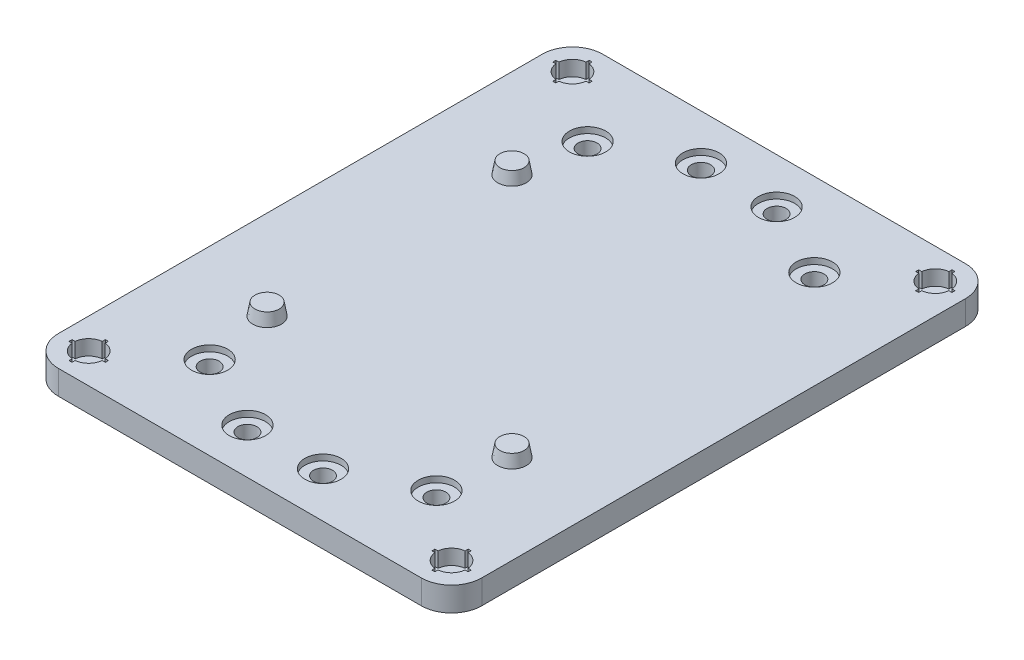
from build123d import *

# Parameters (mm, degrees)
SKETCH_1_W                                 = 200
SKETCH_1_H                                 = 200
SKETCH_1_R                                 = 3.2
SKETCH_1_R_2                               = 3.15
EXTRUDE_1_DEPTH                            = 8
SKETCH_2_R                                 = 6
CUT_EXTRUDE_1_DEPTH                        = 2
SKETCH_3_W                                 = 200
SKETCH_3_H                                 = 200
SKETCH_3_W_2                               = 140
SKETCH_3_H_2                               = 180
CUT_EXTRUDE_2_DEPTH                        = 10
FILLET_1_R                                 = 10
FILLET_2_R                                 = 10
FILLET_3_R                                 = 10
FILLET_4_R                                 = 10
CUT_EXTRUDE_5_DEPTH                        = 5
MIRROR_7_AT_THE_SECOND_PLANE_COPY_1_DEPTH  = 5
SKETCH_15_R                                = 4
EXTRUDE_2_DEPTH                            = 4
DRAFT_3_ANGLE                              = 10
DRAFT_3_OF_MIRROR_13_2_ANGLE               = 10
DRAFT_3_OF_MIRROR_14_2_ANGLE               = 10
SKETCH_16_R                                = 1.2
CUT_EXTRUDE_6_DEPTH                        = 115.297856498
MIRROR_15_AT_THE_SECOND_PLANE_COPY_1_SKE_R = 1.2
MIRROR_15_AT_THE_SECOND_PLANE_COPY_1_DEPTH = 115.297856498


with BuildPart() as part:
    # 草图1 → 凸台-拉伸1 (new body)
    with BuildSketch(Plane(origin=(0, 0, 0), x_dir=(1, 0, 0), z_dir=(0, 1, 0))):
        Rectangle(SKETCH_1_W, SKETCH_1_H)
        with Locations(Location((-12.5, 75, 0), (0, 0, 270))):
            Circle(SKETCH_1_R, mode=Mode.SUBTRACT)
        with Locations(Location((12.5, 75, 0), (0, 0, 270))):
            Circle(SKETCH_1_R_2, mode=Mode.SUBTRACT)
        with Locations(Location((-12.5, -75, 0), (0, 0, 270))):
            Circle(SKETCH_1_R_2, mode=Mode.SUBTRACT)
        with Locations(Location((12.5, -75, 0), (0, 0, 270))):
            Circle(SKETCH_1_R_2, mode=Mode.SUBTRACT)
        with Locations(Location((-37.5, -62.5, 0), (0, 0, 270))):
            Circle(SKETCH_1_R_2, mode=Mode.SUBTRACT)
        with Locations(Location((37.5, -62.5, 0), (0, 0, 270))):
            Circle(SKETCH_1_R_2, mode=Mode.SUBTRACT)
        with Locations(Location((-37.5, 62.5, 0), (0, 0, 270))):
            Circle(SKETCH_1_R_2, mode=Mode.SUBTRACT)
        with Locations(Location((37.5, 62.5, 0), (0, 0, 270))):
            Circle(SKETCH_1_R_2, mode=Mode.SUBTRACT)
    extrude(amount=EXTRUDE_1_DEPTH)

    # 草图2 → 切除-拉伸1 (cut)
    with BuildSketch(Plane(origin=(0, 8, 0), x_dir=(1, 0, 0), z_dir=(0, 1, 0))):
        with Locations(Location((-37.5, 62.5, 0), (0, 0, 270))):
            Circle(SKETCH_2_R)
        with Locations(Location((-12.5, 75, 0), (0, 0, 270))):
            Circle(SKETCH_2_R)
        with Locations(Location((12.5, 75, 0), (0, 0, 270))):
            Circle(SKETCH_2_R)
        with Locations(Location((37.5, 62.5, 0), (0, 0, 270))):
            Circle(SKETCH_2_R)
        with Locations(Location((-37.5, -62.5, 0), (0, 0, 270))):
            Circle(SKETCH_2_R)
        with Locations(Location((-12.5, -75, 0), (0, 0, 270))):
            Circle(SKETCH_2_R)
        with Locations(Location((12.5, -75, 0), (0, 0, 270))):
            Circle(SKETCH_2_R)
        with Locations(Location((37.5, -62.5, 0), (0, 0, 270))):
            Circle(SKETCH_2_R)
    extrude(amount=-CUT_EXTRUDE_1_DEPTH, mode=Mode.SUBTRACT)

    # 草图3 → 切除-拉伸2 (cut)
    with BuildSketch(Plane(origin=(0, 8, 0), x_dir=(1, 0, 0), z_dir=(0, 1, 0))):
        Rectangle(SKETCH_3_W, SKETCH_3_H)
        Rectangle(SKETCH_3_W_2, SKETCH_3_H_2, mode=Mode.SUBTRACT)
    extrude(amount=-CUT_EXTRUDE_2_DEPTH, mode=Mode.SUBTRACT)

    # 圆角1
    fillet_1_edges = [part.edges().sort_by_distance(p)[0] for p in [
        (-70, 4, -90),
    ]]
    fillet(fillet_1_edges, radius=FILLET_1_R)

    # 圆角2
    fillet_2_edges = [part.edges().sort_by_distance(p)[0] for p in [
        (70, 4, -90),
    ]]
    fillet(fillet_2_edges, radius=FILLET_2_R)

    # 圆角3
    fillet_3_edges = [part.edges().sort_by_distance(p)[0] for p in [
        (70, 4, 90),
    ]]
    fillet(fillet_3_edges, radius=FILLET_3_R)

    # 圆角4
    fillet_4_edges = [part.edges().sort_by_distance(p)[0] for p in [
        (-70, 4, 90),
    ]]
    fillet(fillet_4_edges, radius=FILLET_4_R)

    # 草图12 → 切除-拉伸5 (cut)
    with BuildSketch(Plane(origin=(0, 8, 0), x_dir=(1, 0, 0), z_dir=(0, 1, 0))):
        with BuildLine():
            Line((-60.5, 84.974937186), (-60.5, 86))
            Line((-60.5, 86), (-59.5, 86))
            Line((-59.5, 86), (-59.5, 84.974937186))
            ThreePointArc((-59.5, 84.974937186), (-56.464466094, 83.535533906), (-55.025062814, 80.5))
            Line((-55.025062814, 80.5), (-54, 80.5))
            Line((-54, 80.5), (-54, 79.5))
            Line((-54, 79.5), (-55.025062814, 79.5))
            ThreePointArc((-55.025062814, 79.5), (-56.464466094, 76.464466094), (-59.5, 75.025062814))
            Line((-59.5, 75.025062814), (-59.5, 74))
            Line((-59.5, 74), (-60.5, 74))
            Line((-60.5, 74), (-60.5, 75.025062814))
            ThreePointArc((-60.5, 75.025062814), (-63.535533906, 76.464466094), (-64.974937186, 79.5))
            Line((-64.974937186, 79.5), (-66, 79.5))
            Line((-66, 79.5), (-66, 80.5))
            Line((-66, 80.5), (-64.974937186, 80.5))
            ThreePointArc((-64.974937186, 80.5), (-63.535533906, 83.535533906), (-60.5, 84.974937186))
        make_face()
    cut_extrude_5 = extrude(amount=-CUT_EXTRUDE_5_DEPTH, mode=Mode.SUBTRACT)

    # 镜向7: 切除-拉伸5 across plane
    add(cut_extrude_5.mirror(Plane.XY), mode=Mode.SUBTRACT)

    # 镜向7 at the second plane: 切除-拉伸5 across plane
    add(cut_extrude_5.mirror(Plane(origin=(0, 0, 0), x_dir=(0, 0, 1), z_dir=(1, 0, 0))), mode=Mode.SUBTRACT)

    # 镜向7 at the second plane copy 1 sket → 镜向7 at the second plane copy 1 (cut)
    with BuildSketch(Plane(origin=(0, 8, 0), x_dir=(-1, 0, 0), z_dir=(0, 1, 0))):
        with BuildLine():
            Line((-60.5, 84.974937186), (-60.5, 86))
            Line((-60.5, 86), (-59.5, 86))
            Line((-59.5, 86), (-59.5, 84.974937186))
            ThreePointArc((-59.5, 84.974937186), (-56.464466094, 83.535533906), (-55.025062814, 80.5))
            Line((-55.025062814, 80.5), (-54, 80.5))
            Line((-54, 80.5), (-54, 79.5))
            Line((-54, 79.5), (-55.025062814, 79.5))
            ThreePointArc((-55.025062814, 79.5), (-56.464466094, 76.464466094), (-59.5, 75.025062814))
            Line((-59.5, 75.025062814), (-59.5, 74))
            Line((-59.5, 74), (-60.5, 74))
            Line((-60.5, 74), (-60.5, 75.025062814))
            ThreePointArc((-60.5, 75.025062814), (-63.535533906, 76.464466094), (-64.974937186, 79.5))
            Line((-64.974937186, 79.5), (-66, 79.5))
            Line((-66, 79.5), (-66, 80.5))
            Line((-66, 80.5), (-64.974937186, 80.5))
            ThreePointArc((-64.974937186, 80.5), (-63.535533906, 83.535533906), (-60.5, 84.974937186))
        make_face()
    extrude(amount=-MIRROR_7_AT_THE_SECOND_PLANE_COPY_1_DEPTH, mode=Mode.SUBTRACT)

    # 草图15 → 凸台-拉伸2 (add)
    with BuildSketch(Plane(origin=(0, 8, 0), x_dir=(1, 0, 0), z_dir=(0, 1, 0))):
        with Locations(Location((-40.5, -40.5, 0), (0, 0, 270))):
            Circle(SKETCH_15_R)
    extrude_2 = extrude(amount=EXTRUDE_2_DEPTH)

    # 拔模3
    draft_3_faces = [part.faces().sort_by_distance(p)[0] for p in [
        (-40.5, 10, 36.5),
    ]]
    draft(draft_3_faces, Plane(origin=(-40.5, 12, 40.5), x_dir=(0, 0, 1), z_dir=(0, 1, 0)), DRAFT_3_ANGLE)

    # 镜向13: 凸台-拉伸2 across plane
    add(extrude_2.mirror(Plane.XY))

    # 拔模3 of Mirror 13 2
    draft_3_of_mirror_13_2_faces = [part.faces().sort_by_distance(p)[0] for p in [
        (-40.5, 10, -36.5),
    ]]
    draft(draft_3_of_mirror_13_2_faces, Plane(origin=(-40.5, 12, -40.5), x_dir=(0, 0, -1), z_dir=(0, 1, 0)), DRAFT_3_OF_MIRROR_13_2_ANGLE)

    # 镜向14: 凸台-拉伸2 across plane
    add(extrude_2.mirror(Plane(origin=(0, 0, 0), x_dir=(0, 0, 1), z_dir=(1, 0, 0))))

    # 拔模3 of Mirror 14 2
    draft_3_of_mirror_14_2_faces = [part.faces().sort_by_distance(p)[0] for p in [
        (40.5, 10, 36.5),
    ]]
    draft(draft_3_of_mirror_14_2_faces, Plane(origin=(40.5, 12, 40.5), x_dir=(0, 0, 1), z_dir=(0, 1, 0)), DRAFT_3_OF_MIRROR_14_2_ANGLE)

    # 草图16 → 切除-拉伸6 (cut, through all)
    with BuildSketch(Plane(origin=(0, 8, 0), x_dir=(1, 0, 0), z_dir=(0, 1, 0))):
        with Locations(Location((-60, 80, 0), (0, 0, 270))):
            Circle(SKETCH_16_R)
    cut_extrude_6 = extrude(amount=-CUT_EXTRUDE_6_DEPTH, mode=Mode.SUBTRACT)

    # 镜向15: 切除-拉伸6 across plane
    add(cut_extrude_6.mirror(Plane.XY), mode=Mode.SUBTRACT)

    # 镜向15 at the second plane: 切除-拉伸6 across plane
    add(cut_extrude_6.mirror(Plane(origin=(0, 0, 0), x_dir=(0, 0, 1), z_dir=(1, 0, 0))), mode=Mode.SUBTRACT)

    # 镜向15 at the second plane copy 1 ske → 镜向15 at the second plane copy 1 (cut, through all)
    with BuildSketch(Plane(origin=(0, 8, 0), x_dir=(-1, 0, 0), z_dir=(0, 1, 0))):
        with Locations(Location((-60, 80, 0), (0, 0, 270))):
            Circle(MIRROR_15_AT_THE_SECOND_PLANE_COPY_1_SKE_R)
    extrude(amount=-MIRROR_15_AT_THE_SECOND_PLANE_COPY_1_DEPTH, mode=Mode.SUBTRACT)


solid = part.part
